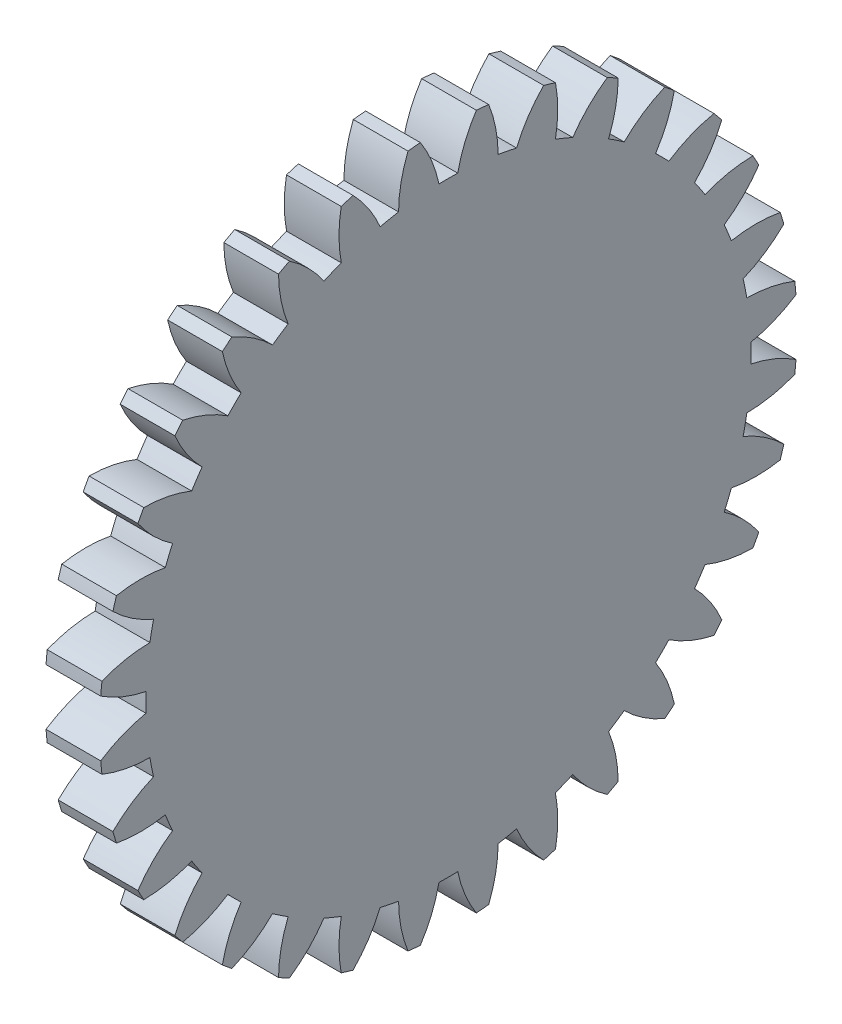
from build123d import *

# Parameters (mm, degrees)
BASPROSKE_W         = 4
BASPROSKE_H         = 25.5
TOOTHCUT_DEPTH      = 37.283605113
TEETHCUTS_COUNT     = 32
TEETHCUTS_ANGLE     = 348.75
BORSKE_R            = 2.5
BORE_DEPTH          = 50.0000508
BOSS_EXTRUDE1_START = -4
SKETCH1_R           = 2.5
BOSS_EXTRUDE1_DEPTH = 4
SKETCH2_R           = 7.2
CUT_EXTRUDE1_DEPTH  = 2


with BuildPart() as part:
    # BasProSke → Base-Revolve (revolve)
    with BuildSketch(Plane(origin=(0, 0, 0), x_dir=(1, 0, 0), z_dir=(0, 1, 0)), mode=Mode.PRIVATE) as base_revolve_sk:
        with Locations((2, 12.75)):
            Rectangle(BASPROSKE_W, BASPROSKE_H)
    revolve(base_revolve_sk.sketch.rotate(Axis((-10, 0, 0), (1, 0, 0)), 180), axis=Axis((-10, 0, 0), (1, 0, 0)))

    # TooCutSke → ToothCut (cut, through all)
    with BuildSketch(Plane(origin=(0, 0, 0), x_dir=(0, 0, -1), z_dir=(1, 0, 0))):
        with BuildLine():
            ThreePointArc((0.686701955, 22.113340237), (0, 22.124), (-0.686701955, 22.113340237))
            ThreePointArc((-0.686701955, 22.113340237), (-1.218174602, 23.842764806), (-2.064691256, 25.441758885))
            ThreePointArc((-2.064691256, 25.441758885), (0, 25.5254), (2.064691256, 25.441758885))
            ThreePointArc((2.064691256, 25.441758885), (1.218174602, 23.842764806), (0.686701955, 22.113340237))
        make_face()
    toothcut = extrude(amount=TOOTHCUT_DEPTH, mode=Mode.SUBTRACT)

    # TeethCuts: ToothCut ×32 about axis
    teethcuts_axis = Axis((-10, 0, 0), (1, 0, 0))
    for i in range(1, TEETHCUTS_COUNT):
        add(toothcut.rotate(teethcuts_axis, i * TEETHCUTS_ANGLE / (TEETHCUTS_COUNT - 1)), mode=Mode.SUBTRACT)

    # BorSke → Bore (cut, symmetric)
    with BuildSketch(Plane(origin=(0, 0, 0), x_dir=(0, 0, -1), z_dir=(1, 0, 0))):
        with Locations(Location((0, 0, 0), (0, 0, 180))):
            Circle(BORSKE_R)
    extrude(amount=BORE_DEPTH, both=True, mode=Mode.SUBTRACT)

    # Sketch1 → Boss-Extrude1 (add)
    with BuildSketch(Plane.ZY.offset(BOSS_EXTRUDE1_START)):
        Circle(SKETCH1_R)
    extrude(amount=BOSS_EXTRUDE1_DEPTH)

    # Sketch2 → Cut-Extrude1 (cut)
    with BuildSketch(Plane.ZY):
        Circle(SKETCH2_R)
    extrude(amount=-CUT_EXTRUDE1_DEPTH, mode=Mode.SUBTRACT)


solid = part.part
